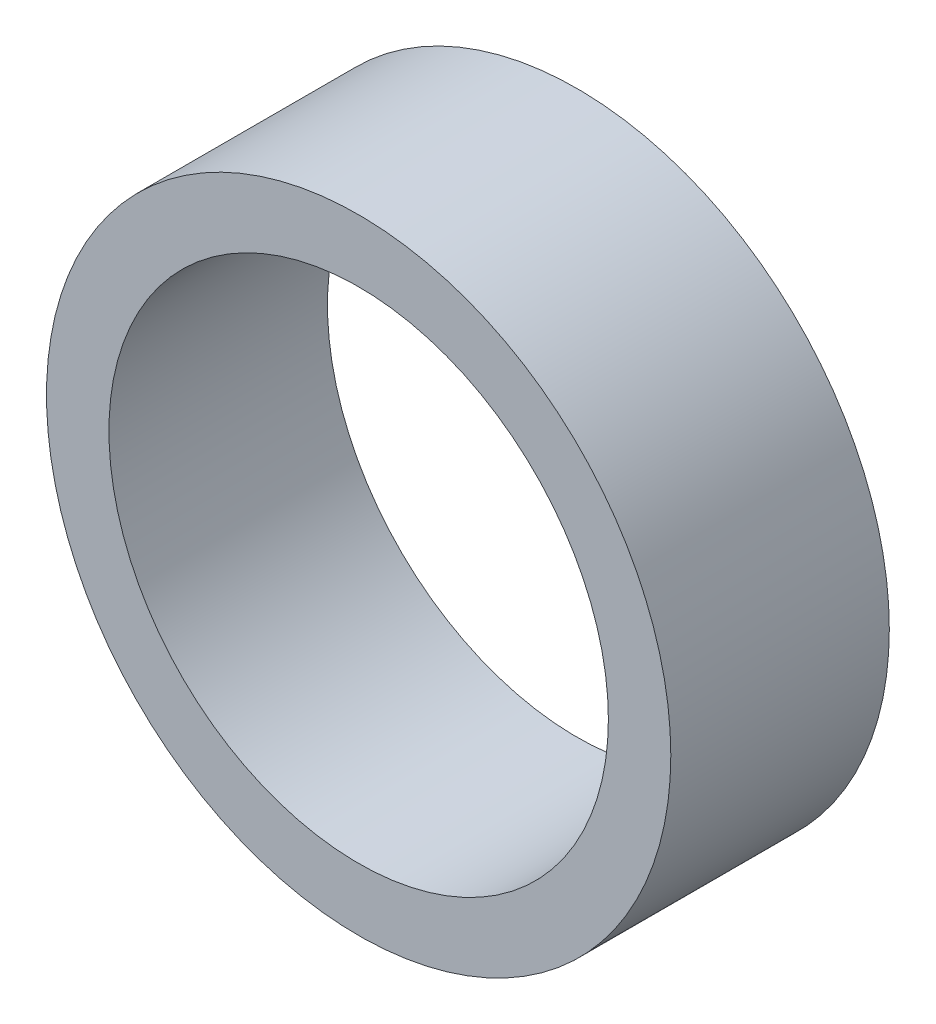
from build123d import *

# Parameters (mm, degrees)
SKETCH_2_R      = 5
SKETCH_2_R_2    = 4
EXTRUDE_1_DEPTH = 3.5


with BuildPart() as part:
    # 草图2 → 凸台-拉伸1 (new body)
    with BuildSketch(Plane.XY):
        Circle(SKETCH_2_R)
        Circle(SKETCH_2_R_2, mode=Mode.SUBTRACT)
    extrude(amount=EXTRUDE_1_DEPTH)


solid = part.part
